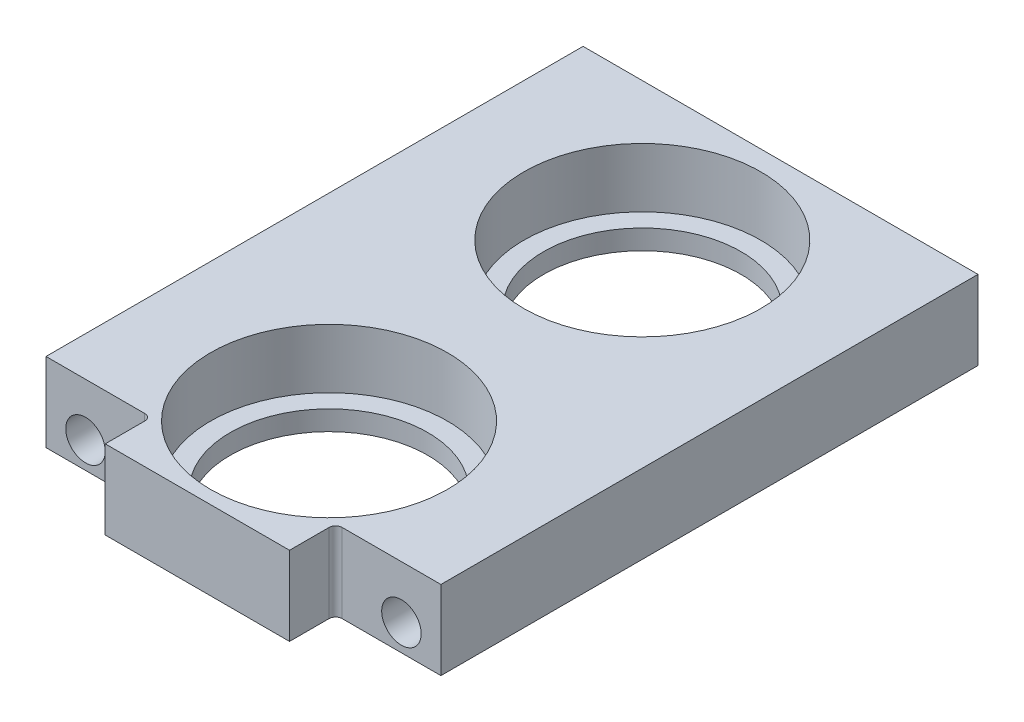
from build123d import *

# Parameters (mm, degrees)
SKETCH_1_W             = 30
SKETCH_1_H             = 44.3
EXTRUDE_1_DEPTH        = 6
SKETCH_2_R             = 9
CUT_EXTRUDE_1_DEPTH    = 4.5
SKETCH_3_R             = 7.5
CUT_EXTRUDE_2_DEPTH    = 4.5
SKETCH_5_W             = 8
SKETCH_5_H             = 3.5
CUT_EXTRUDE_3_DEPTH    = 10
FILLET_1_R             = 0.5
SKETCH_6_R             = 1.5
CUT_EXTRUDE_1251_DEPTH = 5


with BuildPart() as part:
    # 草图1 → 凸台-拉伸1 (new body)
    with BuildSketch(Plane(origin=(0, 0, 0), x_dir=(1, 0, 0), z_dir=(0, 1, 0))):
        Rectangle(SKETCH_1_W, SKETCH_1_H)
    extrude(amount=EXTRUDE_1_DEPTH)

    # 草图2 → 切除-拉伸1 (cut)
    with BuildSketch(Plane(origin=(0, 6, 0), x_dir=(1, 0, 0), z_dir=(0, 1, 0))):
        with Locations(Location((0, 11.65, 0), (0, 0, 270))):
            Circle(SKETCH_2_R)
        with Locations(Location((0, -12.15, 0), (0, 0, 270))):
            Circle(SKETCH_2_R)
    extrude(amount=-CUT_EXTRUDE_1_DEPTH, mode=Mode.SUBTRACT)

    # 草图3 → 切除-拉伸2 (cut)
    with BuildSketch(Plane(origin=(0, 1.5, 0), x_dir=(1, 0, 0), z_dir=(0, 1, 0))):
        with Locations(Location((0, 11.65, 0), (0, 0, 270))):
            Circle(SKETCH_3_R)
        with Locations(Location((0, -12.15, 0), (0, 0, 270))):
            Circle(SKETCH_3_R)
    extrude(amount=-CUT_EXTRUDE_2_DEPTH, mode=Mode.SUBTRACT)

    # 草图5 → 切除-拉伸3 (cut)
    with BuildSketch(Plane(origin=(0, 6, 0), x_dir=(1, 0, 0), z_dir=(0, 1, 0))):
        with Locations((11, -20.4)):
            Rectangle(SKETCH_5_W, SKETCH_5_H)
        with Locations((-11, -20.4)):
            Rectangle(SKETCH_5_W, SKETCH_5_H)
    extrude(amount=-CUT_EXTRUDE_3_DEPTH, mode=Mode.SUBTRACT)

    # 圆角1
    fillet_1_edges = [part.edges().sort_by_distance(p)[0] for p in [
        (-7, 3, 18.65),
        (7, 3, 18.65),
    ]]
    fillet(fillet_1_edges, radius=FILLET_1_R)

    # 草图6 → Cut-Extrude 1251 (cut)
    with BuildSketch(Plane.XY.offset(18.65)):
        with Locations((-12, 2)):
            Circle(SKETCH_6_R)
        with Locations(Location((12, 2, 0), (0, 0, 180))):
            Circle(SKETCH_6_R)
    extrude(amount=-CUT_EXTRUDE_1251_DEPTH, mode=Mode.SUBTRACT)


solid = part.part
